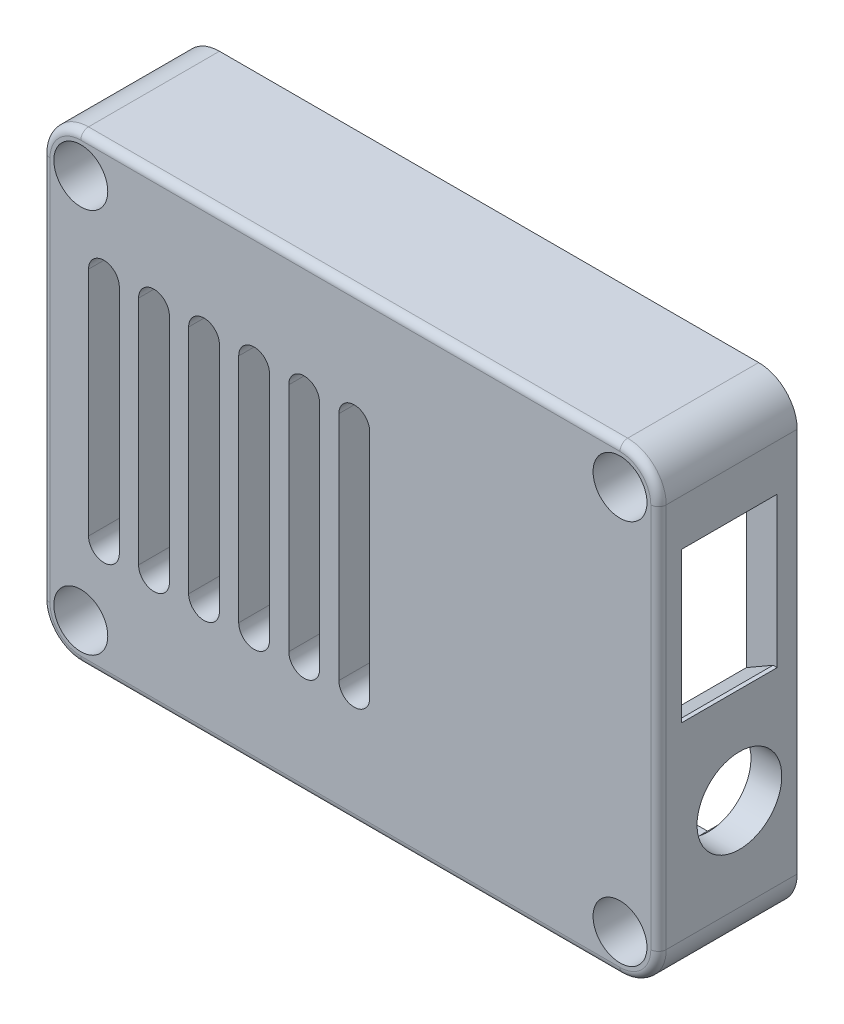
from build123d import *

# Parameters (mm, degrees)
BOSS_EXTRUDE1_DEPTH = 18
CUT_EXTRUDE1_DEPTH  = 7
SKETCH3_R           = 5.5
SKETCH3_W           = 12.4
SKETCH3_H           = 19.5
CUT_EXTRUDE2_DEPTH  = 22
CUT_EXTRUDE3_DEPTH  = 8
FILLET1_R           = 1
SKETCH7_W           = 40.5
SKETCH7_H           = 40.5
CUT_EXTRUDE5_DEPTH  = 5
CUT_EXTRUDE7_DEPTH  = 52.419840529
SKETCH10_R          = 3.5
CUT_EXTRUDE8_DEPTH  = 14
SKETCH11_R          = 1.85
CUT_EXTRUDE9_DEPTH  = 52.923019943
CHAMFER1_SIZE       = 2
CHAMFER1_SIZE2      = 3.464101615


with BuildPart() as part:
    # Sketch1 → Boss-Extrude1 (new body)
    with BuildSketch(Plane.XY):
        with BuildLine():
            Line((-35, 30), (35, 30))
            ThreePointArc((35, 30), (38.535533906, 28.535533906), (40, 25))
            Line((40, 25), (40, -25))
            ThreePointArc((40, -25), (38.535533906, -28.535533906), (35, -30))
            Line((35, -30), (-35, -30))
            ThreePointArc((-35, -30), (-38.535533906, -28.535533906), (-40, -25))
            Line((-40, -25), (-40, 25))
            ThreePointArc((-40, 25), (-38.535533906, 28.535533906), (-35, 30))
        make_face()
    extrude(amount=BOSS_EXTRUDE1_DEPTH)

    # Sketch2 → Cut-Extrude1 (cut)
    with BuildSketch(Plane(origin=(0, 0, 0), x_dir=(-1, 0, 0), z_dir=(0, 0, -1))):
        with BuildLine():
            Line((-36, 21.127016654), (-36, -21.127016654))
            ThreePointArc((-36, -21.127016654), (-32.171572875, -22.171572875), (-31.127016654, -26))
            Line((-31.127016654, -26), (31.127016654, -26))
            ThreePointArc((31.127016654, -26), (32.171572875, -22.171572875), (36, -21.127016654))
            Line((36, -21.127016654), (36, 21.127016654))
            ThreePointArc((36, 21.127016654), (32.171572875, 22.171572875), (31.127016654, 26))
            Line((31.127016654, 26), (-31.127016654, 26))
            ThreePointArc((-31.127016654, 26), (-32.171572875, 22.171572875), (-36, 21.127016654))
        make_face()
    extrude(amount=-CUT_EXTRUDE1_DEPTH, mode=Mode.SUBTRACT)

    # Sketch3 → Cut-Extrude2 (cut)
    with BuildSketch(Plane(origin=(40, 0, 0), x_dir=(0, 0, -1), z_dir=(1, 0, 0))):
        with Locations(Location((-7.5, -13, 0), (0, 0, 90))):
            Circle(SKETCH3_R)
        with Locations((-8.8, 9.25)):
            Rectangle(SKETCH3_W, SKETCH3_H)
    extrude(amount=-CUT_EXTRUDE2_DEPTH, mode=Mode.SUBTRACT)

    # Sketch4 → Cut-Extrude3 (cut)
    with BuildSketch(Plane(origin=(0, 0, 7), x_dir=(-1, 0, 0), z_dir=(0, 0, -1))):
        with BuildLine():
            Line((-31.127016654, -26), (-7, -26))
            Line((-7, -26), (-7, 26))
            Line((-7, 26), (-31.127016654, 26))
            ThreePointArc((-31.127016654, 26), (-32.171572875, 22.171572875), (-36, 21.127016654))
            Line((-36, 21.127016654), (-36, -21.127016654))
            ThreePointArc((-36, -21.127016654), (-32.171572875, -22.171572875), (-31.127016654, -26))
        make_face()
    extrude(amount=-CUT_EXTRUDE3_DEPTH, mode=Mode.SUBTRACT)

    # Fillet1
    fillet1_edges = [part.edges().sort_by_distance(p)[0] for p in [
        (-38.535533906, 28.535533906, 18),
        (-40, 0, 18),
        (-38.535533906, -28.535533906, 18),
        (0, -30, 18),
        (38.535533906, -28.535533906, 18),
        (40, 0, 18),
        (38.535533906, 28.535533906, 18),
        (0, 30, 18),
    ]]
    fillet(fillet1_edges, radius=FILLET1_R)

    # Sketch7 → Cut-Extrude5 (cut)
    with BuildSketch(Plane(origin=(0, 0, 7), x_dir=(-1, 0, 0), z_dir=(0, 0, -1))):
        with Locations((15.75, 0)):
            Rectangle(SKETCH7_W, SKETCH7_H)
    extrude(amount=-CUT_EXTRUDE5_DEPTH, mode=Mode.SUBTRACT)

    # Sketch9 → Cut-Extrude7 (cut, through all)
    with BuildSketch(Plane(origin=(0, 0, 12), x_dir=(-1, 0, 0), z_dir=(0, 0, -1))):
        with BuildLine():
            Line((1.5, 15), (1.5, -15))
            ThreePointArc((1.5, -15), (-0.5, -17), (-2.5, -15))
            Line((-2.5, -15), (-2.5, 15))
            ThreePointArc((-2.5, 15), (-0.5, 17), (1.5, 15))
        make_face()
        with BuildLine():
            Line((8, 15), (8, -15))
            ThreePointArc((8, -15), (6, -17), (4, -15))
            Line((4, -15), (4, 15))
            ThreePointArc((4, 15), (6, 17), (8, 15))
        make_face()
        with BuildLine():
            Line((14.5, 15), (14.5, -15))
            ThreePointArc((14.5, -15), (12.5, -17), (10.5, -15))
            Line((10.5, -15), (10.5, 15))
            ThreePointArc((10.5, 15), (12.5, 17), (14.5, 15))
        make_face()
        with BuildLine():
            Line((21, 15), (21, -15))
            ThreePointArc((21, -15), (19, -17), (17, -15))
            Line((17, -15), (17, 15))
            ThreePointArc((17, 15), (19, 17), (21, 15))
        make_face()
        with BuildLine():
            Line((27.5, 15), (27.5, -15))
            ThreePointArc((27.5, -15), (25.5, -17), (23.5, -15))
            Line((23.5, -15), (23.5, 15))
            ThreePointArc((23.5, 15), (25.5, 17), (27.5, 15))
        make_face()
        with BuildLine():
            Line((34, 15), (34, -15))
            ThreePointArc((34, -15), (32, -17), (30, -15))
            Line((30, -15), (30, 15))
            ThreePointArc((30, 15), (32, 17), (34, 15))
        make_face()
    extrude(amount=-CUT_EXTRUDE7_DEPTH, mode=Mode.SUBTRACT)

    # Sketch10 → Cut-Extrude8 (cut)
    with BuildSketch(Plane.XY.offset(18)):
        with Locations((-35, 25)):
            Circle(SKETCH10_R)
        with Locations((-35, -25)):
            Circle(SKETCH10_R)
        with Locations((35, -25)):
            Circle(SKETCH10_R)
        with Locations((35, 25)):
            Circle(SKETCH10_R)
    extrude(amount=-CUT_EXTRUDE8_DEPTH, mode=Mode.SUBTRACT)

    # Sketch11 → Cut-Extrude9 (cut, through all)
    with BuildSketch(Plane.XY.offset(4)):
        with Locations((35, -25)):
            Circle(SKETCH11_R)
        with Locations((35, 25)):
            Circle(SKETCH11_R)
        with Locations((-35, 25)):
            Circle(SKETCH11_R)
        with Locations((-35, -25)):
            Circle(SKETCH11_R)
    extrude(amount=-CUT_EXTRUDE9_DEPTH, mode=Mode.SUBTRACT)

    # Chamfer1
    chamfer1_edges = [part.edges().sort_by_distance(p)[0] for p in [
        (36, -0.5, 8.8),
        (36, 19, 8.8),
    ]]
    chamfer1_side = [part.faces().sort_by_distance(p)[0] for p in [
        (36, -3.371364126, 6.44153534),
    ]]
    chamfer(chamfer1_edges, length=CHAMFER1_SIZE, length2=CHAMFER1_SIZE2, reference=chamfer1_side[0])


solid = part.part
